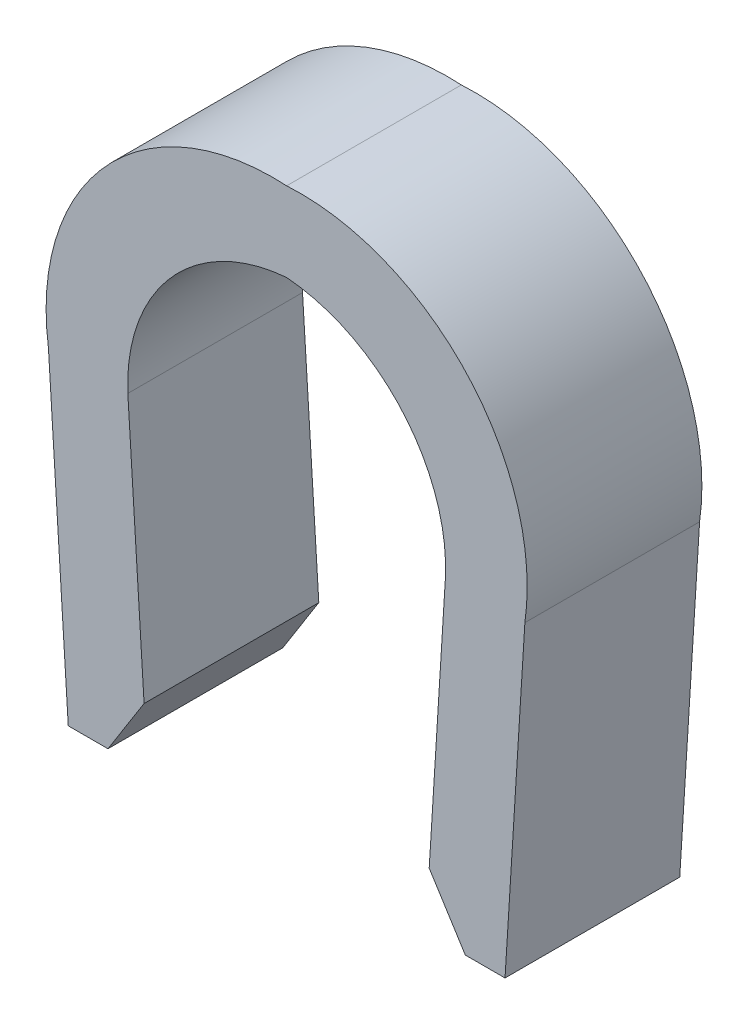
from build123d import *

# Parameters (mm, degrees)
BOSS_EXTRUDE1_DEPTH     = 4.4
CUT_EXTRUDE2_DEPTH      = 13.739679342
CUT_EXTRUDE2_DEPTH_BACK = 13.739679342


with BuildPart() as part:
    # Sketch1 → Boss-Extrude1 (new body)
    with BuildSketch(Plane.XY):
        with BuildLine():
            Line((-4, 3.769318743), (-3.5, -4.230681257))
            Line((-3.5, -4.230681257), (-5.5, -4.230681257))
            Line((-5.5, -4.230681257), (-6, 3.769318743))
            ThreePointArc((-6, 3.769318743), (-4.547652978, 8.455926386), (0, 10.297788342))
            ThreePointArc((0, 10.297788342), (4.547652978, 8.455926386), (6, 3.769318743))
            Line((6, 3.769318743), (5.5, -4.230681257))
            Line((5.5, -4.230681257), (3.5, -4.230681257))
            Line((3.5, -4.230681257), (4, 3.769318743))
            ThreePointArc((4, 3.769318743), (2.912733302, 6.839771433), (0, 8.297788342))
            ThreePointArc((0, 8.297788342), (-2.912733302, 6.839771433), (-4, 3.769318743))
        make_face()
    extrude(amount=BOSS_EXTRUDE1_DEPTH)

    # Sketch2 → Cut-Extrude2 (cut, two sides: drawn at the far end of the back side and taken through both)
    with BuildSketch(Plane.XY.offset(-CUT_EXTRUDE2_DEPTH_BACK)):
        Polygon((-3.5, -4.230681257), (-4.5, -4.230681257), (-3.590096666, -2.789134598), align=None)
        Polygon((3.5, -4.230681257), (3.590096666, -2.789134598), (4.5, -4.230681257), align=None)
    extrude(amount=CUT_EXTRUDE2_DEPTH + CUT_EXTRUDE2_DEPTH_BACK, mode=Mode.SUBTRACT)


solid = part.part
